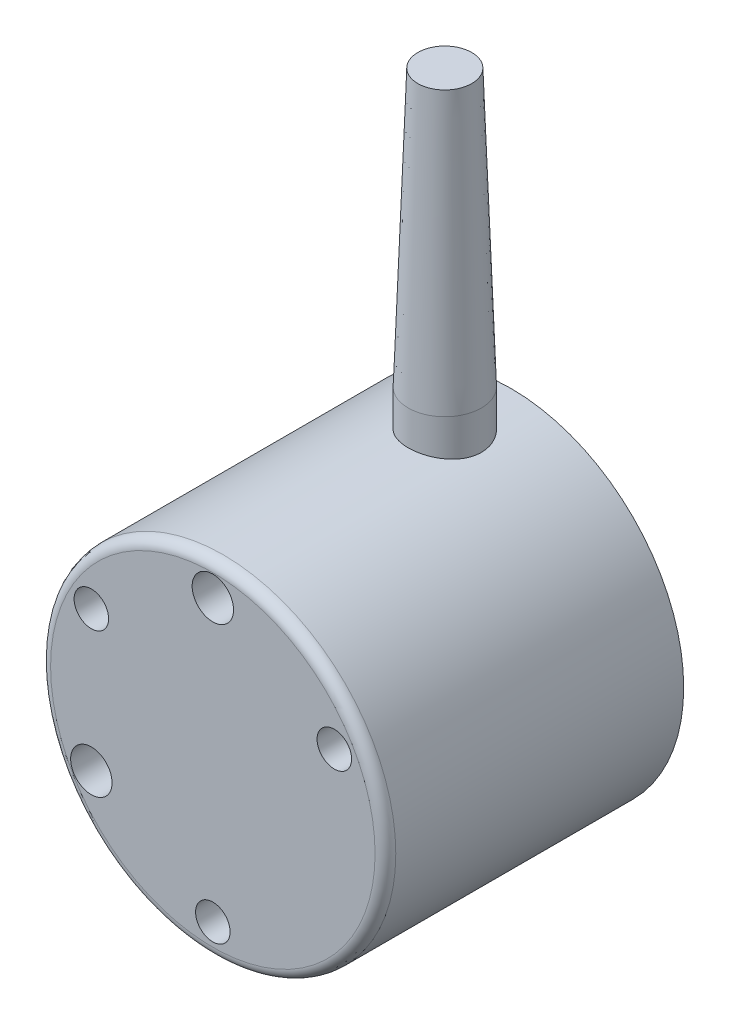
from build123d import *

# Parameters (mm, degrees)
BOSS_EXTRUDE1_DEPTH                 = 16.8
BOSS_EXTRUDE1_DEPTH_BACK            = 4.8
SKETCH1_R                           = 12.5
CIRPATTERN1_COUNT                   = 3
F_3_0MM_CLEARANCE_DOWEL_HOLE1_D     = 3
F_3_0MM_CLEARANCE_DOWEL_HOLE1_DEPTH = 3.3
F_3_0MM_CLEARANCE_DOWEL_HOLE1_TIP   = 0.901290929
CIRPATTERN2_COUNT                   = 3
F_3_0MM_CLEARANCE_DOWEL_HOLE2_D     = 3
F_3_0MM_CLEARANCE_DOWEL_HOLE2_DEPTH = 3.3
F_3_0MM_CLEARANCE_DOWEL_HOLE2_TIP   = 0.901290929
SKETCH10_R                          = 3.0175
CUT_EXTRUDE1_DEPTH                  = 2.1
FILLET1_R                           = 0.75
SKETCH11_R                          = 2.65
BOSS_EXTRUDE2_DEPTH                 = 15
SKETCH12_R                          = 2.65
BOSS_EXTRUDE3_DEPTH                 = 20
BOSS_EXTRUDE3_TAPER                 = 2


with BuildPart() as part:
    # Sketch1 → Boss-Extrude1 (new, two sides: drawn at the far end of the back side and taken through both)
    with BuildSketch(Plane.XY.offset(-BOSS_EXTRUDE1_DEPTH_BACK)):
        Circle(SKETCH1_R)
    extrude(amount=BOSS_EXTRUDE1_DEPTH + BOSS_EXTRUDE1_DEPTH_BACK)

    # Sketch2 → M3x0.5 Tapped Hole1 (revolve, cut)
    with BuildSketch(Plane(origin=(0, -10.16, 16.8), x_dir=(0, -1, 0), z_dir=(1, 0, 0))):
        Polygon((0, 0), (0, 8.251075774), (1.25, 7.5), (1.25, 0), align=None)
    m3x0_5_tapped_hole1 = revolve(axis=Axis((0, -10.16, 23.15), (0, 0, -1)), mode=Mode.SUBTRACT)

    # CirPattern1: M3x0.5 Tapped Hole1 ×3 about axis
    cirpattern1_axis = Axis((0, 0, -88.99), (0, 0, 1))
    for i in range(1, CIRPATTERN1_COUNT):
        add(m3x0_5_tapped_hole1.rotate(cirpattern1_axis, i * 360 / CIRPATTERN1_COUNT), mode=Mode.SUBTRACT)

    # Ø3.0mm Clearance Dowel Hole1
    with Locations(Plane.XY.offset(16.8)):
        with Locations((-8.799, -5.08), (0, 10.16)):
            Hole(F_3_0MM_CLEARANCE_DOWEL_HOLE1_D / 2, depth=F_3_0MM_CLEARANCE_DOWEL_HOLE1_DEPTH)
            with Locations((0, 0, -(F_3_0MM_CLEARANCE_DOWEL_HOLE1_DEPTH + F_3_0MM_CLEARANCE_DOWEL_HOLE1_TIP / 2))):  # 118° drill point
                Cone(0, F_3_0MM_CLEARANCE_DOWEL_HOLE1_D / 2, F_3_0MM_CLEARANCE_DOWEL_HOLE1_TIP, mode=Mode.SUBTRACT)

    # Sketch6 → M3x0.5 Tapped Hole2 (revolve, cut)
    with BuildSketch(Plane(origin=(-10.16, 0, -4.8), x_dir=(0, 1, 0), z_dir=(1, 0, 0))):
        Polygon((0, 0), (0, 8.251075774), (1.25, 7.5), (1.25, 0), align=None)
    m3x0_5_tapped_hole2 = revolve(axis=Axis((-10.16, 0, -11.15), (0, 0, 1)), mode=Mode.SUBTRACT)

    # CirPattern2: M3x0.5 Tapped Hole2 ×3 about axis
    cirpattern2_axis = Axis((0, 0, -88.99), (0, 0, 1))
    for i in range(1, CIRPATTERN2_COUNT):
        add(m3x0_5_tapped_hole2.rotate(cirpattern2_axis, i * 360 / CIRPATTERN2_COUNT), mode=Mode.SUBTRACT)

    # Ø3.0mm Clearance Dowel Hole2
    with Locations(Plane(origin=(0, 0, -4.8), x_dir=(-1, 0, 0), z_dir=(0, 0, -1))):
        with Locations((-9.208, -4.294)):
            Hole(F_3_0MM_CLEARANCE_DOWEL_HOLE2_D / 2, depth=F_3_0MM_CLEARANCE_DOWEL_HOLE2_DEPTH)
            with Locations((0, 0, -(F_3_0MM_CLEARANCE_DOWEL_HOLE2_DEPTH + F_3_0MM_CLEARANCE_DOWEL_HOLE2_TIP / 2))):  # 118° drill point
                Cone(0, F_3_0MM_CLEARANCE_DOWEL_HOLE2_D / 2, F_3_0MM_CLEARANCE_DOWEL_HOLE2_TIP, mode=Mode.SUBTRACT)

    # Sketch10 → Cut-Extrude1 (cut)
    with BuildSketch(Plane(origin=(0, 0, -4.8), x_dir=(-1, 0, 0), z_dir=(0, 0, -1))):
        Circle(SKETCH10_R)
    extrude(amount=-CUT_EXTRUDE1_DEPTH, mode=Mode.SUBTRACT)

    # Fillet1
    fillet1_edges = [part.edges().sort_by_distance(p)[0] for p in [
        (-12.5, 0, 16.8),
    ]]
    fillet(fillet1_edges, radius=FILLET1_R)

    # Sketch11 → Boss-Extrude2 (add)
    with BuildSketch(Plane(origin=(0, 0, 0), x_dir=(1, 0, 0), z_dir=(0, 1, 0))):
        Circle(SKETCH11_R)
    extrude(amount=BOSS_EXTRUDE2_DEPTH)

    # Sketch12 → Boss-Extrude3 (add)
    with BuildSketch(Plane(origin=(0, 15, 0), x_dir=(1, 0, 0), z_dir=(0, 1, 0))):
        Circle(SKETCH12_R)
    extrude(amount=BOSS_EXTRUDE3_DEPTH, taper=BOSS_EXTRUDE3_TAPER)


solid = part.part
